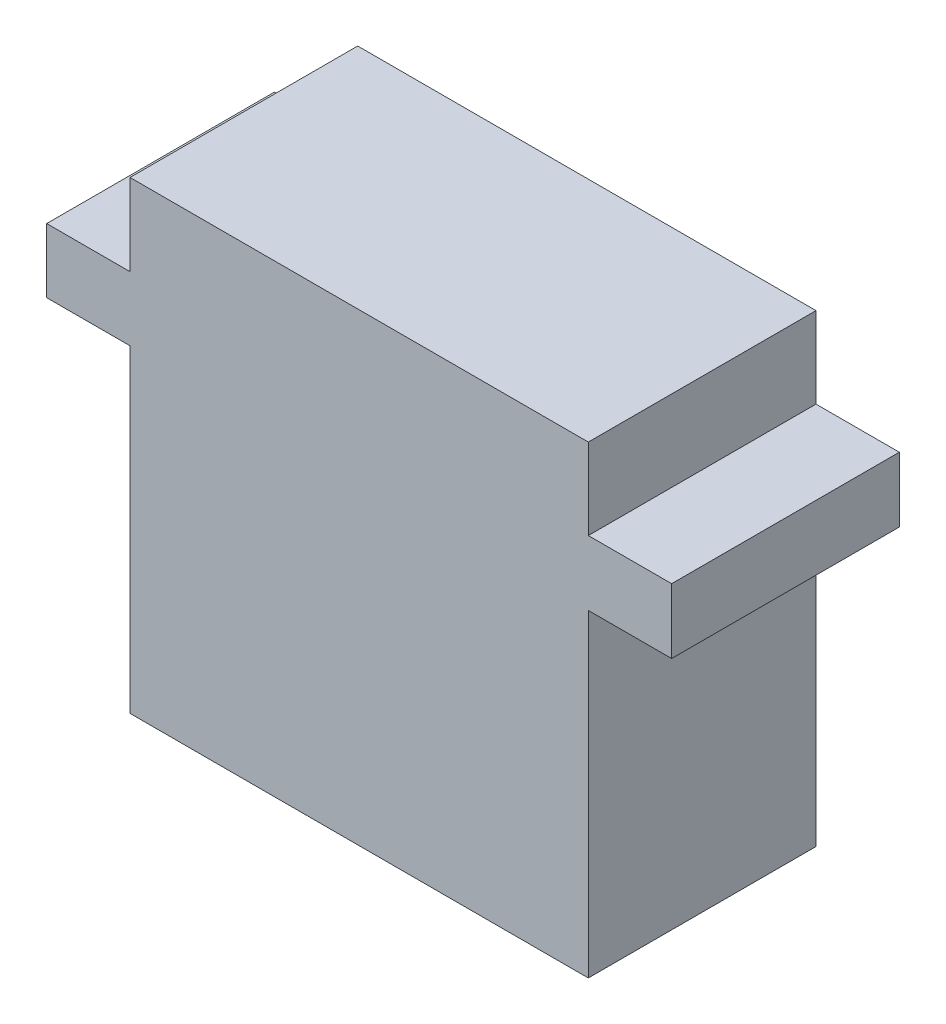
from build123d import *

# Parameters (mm, degrees)
SKETCH2_W           = 39.878
SKETCH2_H           = 19.812
BOSS_EXTRUDE1_DEPTH = 40.386
SKETCH3_W           = 19.812
SKETCH3_H           = 5.640095975
BOSS_EXTRUDE2_DEPTH = 7.25
SKETCH4_W           = 19.812
SKETCH4_H           = 5.588
BOSS_EXTRUDE3_DEPTH = 7.25


with BuildPart() as part:
    # Sketch2 → Boss-Extrude1 (new body)
    with BuildSketch(Plane(origin=(0, 0, 0), x_dir=(1, 0, 0), z_dir=(0, 1, 0))):
        with Locations((19.939, 9.906)):
            Rectangle(SKETCH2_W, SKETCH2_H)
    extrude(amount=BOSS_EXTRUDE1_DEPTH)

    # Sketch3 → Boss-Extrude2 (add)
    with BuildSketch(Plane(origin=(39.878, 0, 0), x_dir=(0, 0, -1), z_dir=(1, 0, 0))):
        with Locations((9.906, 30.520047988)):
            Rectangle(SKETCH3_W, SKETCH3_H)
    extrude(amount=BOSS_EXTRUDE2_DEPTH)

    # Sketch4 → Boss-Extrude3 (add)
    with BuildSketch(Plane.ZY):
        with Locations((-9.906, 30.494)):
            Rectangle(SKETCH4_W, SKETCH4_H)
    extrude(amount=BOSS_EXTRUDE3_DEPTH)


solid = part.part
